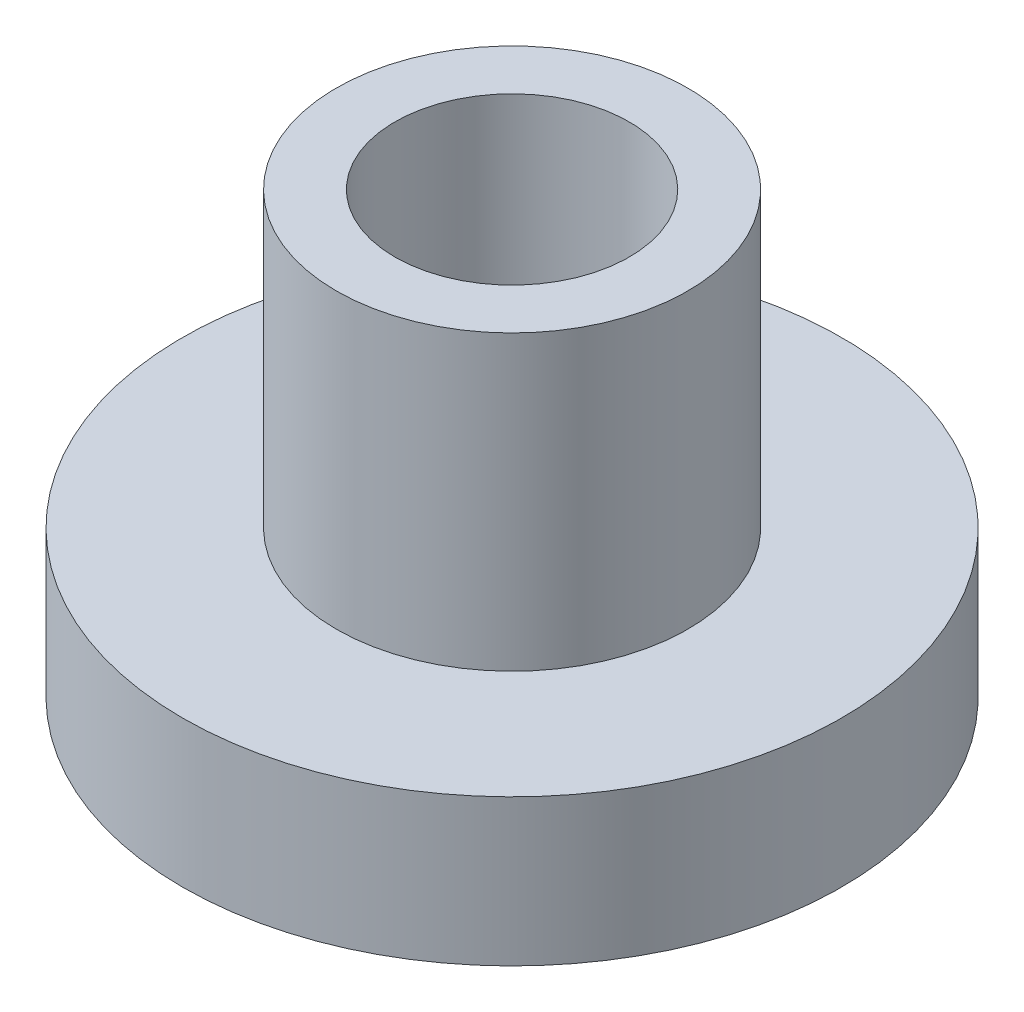
from build123d import *


with BuildPart() as part:
    # Esquisse1 → Révolution1 (revolve)
    with BuildSketch(Plane(origin=(0, 0, 0), x_dir=(0, 0, -1), z_dir=(1, 0, 0))):
        Polygon((-1.6, 0), (-1.6, 6), (-2.4, 6), (-2.4, 2), (-4.5, 2), (-4.5, 0), align=None)
    revolve(axis=Axis((0, 6.848058206, 0), (0, -1, 0)))


solid = part.part
